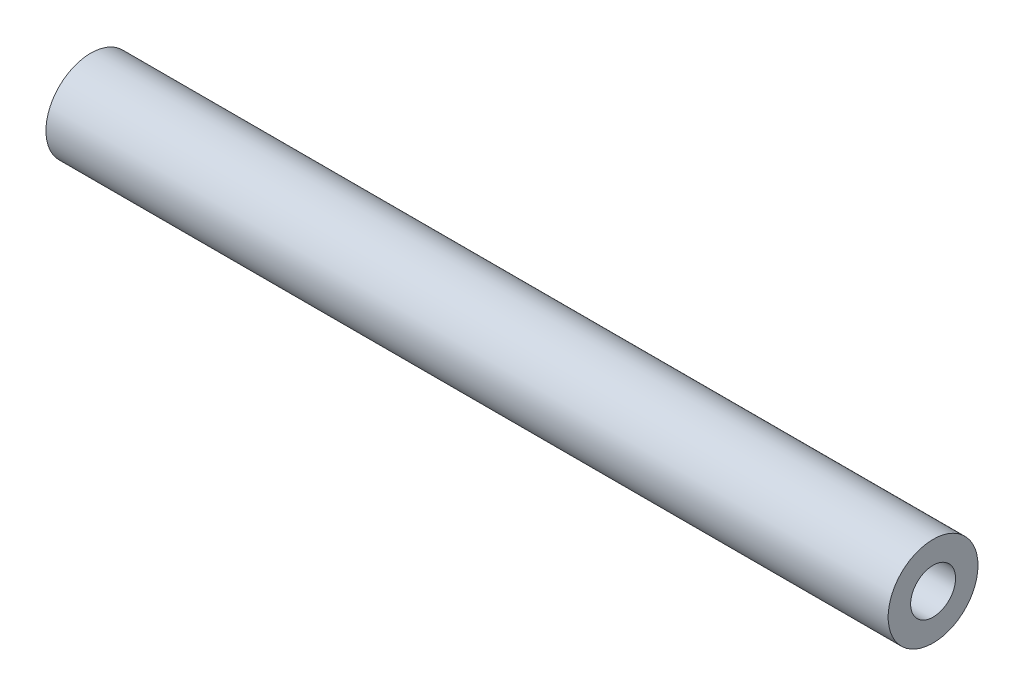
from build123d import *

# Parameters (mm, degrees)
SKETCH1_R           = 4
BOSS_EXTRUDE1_DEPTH = 37.5
SKETCH2_R           = 2
CUT_EXTRUDE1_DEPTH  = 15


with BuildPart() as part:
    # Sketch1 → Boss-Extrude1 (new, symmetric)
    with BuildSketch(Plane(origin=(0, 0, 0), x_dir=(0, 0, -1), z_dir=(1, 0, 0))):
        Circle(SKETCH1_R)
    extrude(amount=BOSS_EXTRUDE1_DEPTH, both=True)

    # Sketch2 → Cut-Extrude1 (cut)
    with BuildSketch(Plane(origin=(37.5, 0, 0), x_dir=(0, 0, -1), z_dir=(1, 0, 0))):
        Circle(SKETCH2_R)
    cut_extrude1 = extrude(amount=-CUT_EXTRUDE1_DEPTH, mode=Mode.SUBTRACT)

    # Mirror1: Cut-Extrude1 across plane
    add(cut_extrude1.mirror(Plane(origin=(0, 0, 0), x_dir=(0, 0, 1), z_dir=(1, 0, 0))), mode=Mode.SUBTRACT)


solid = part.part
